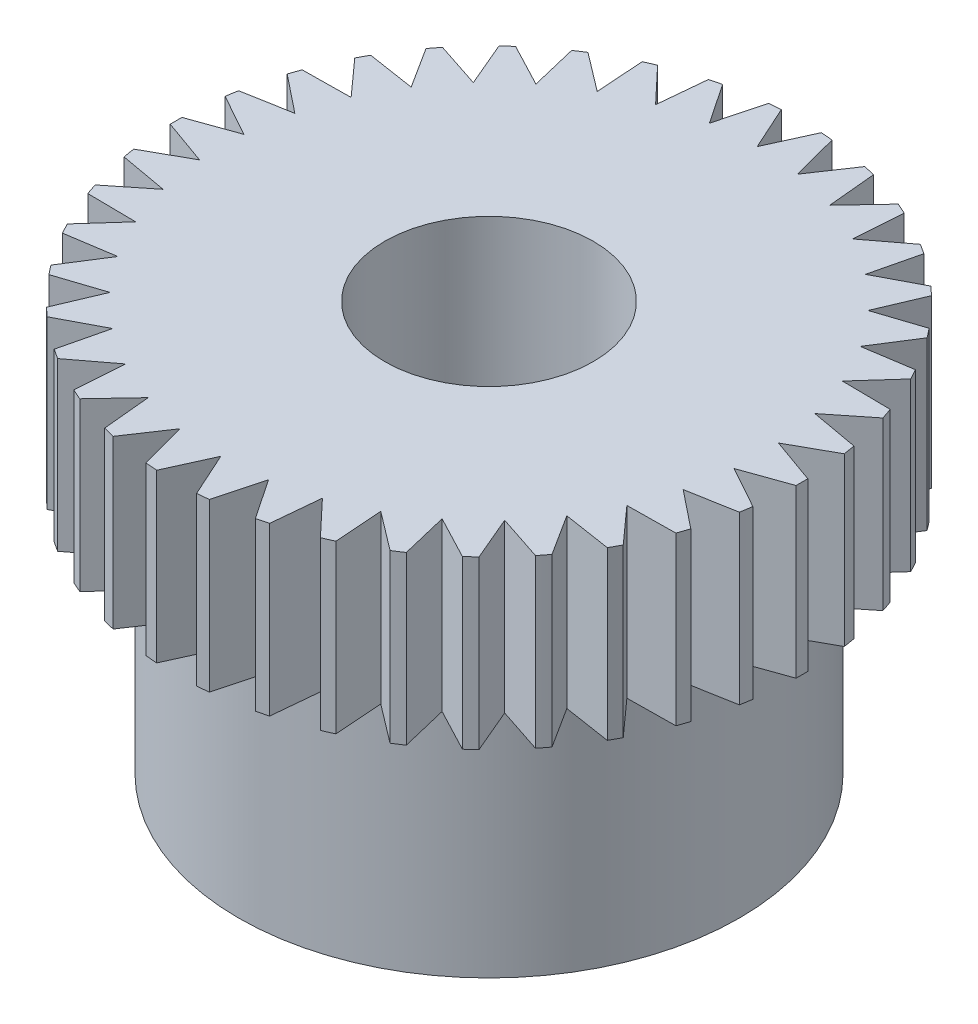
from build123d import *

# Parameters (mm, degrees)
SKETCH_1_R          = 6
EXTRUDE_1_DEPTH     = 5.8
SKETCH_2_R          = 7.5
EXTRUDE_2_DEPTH     = 4
CUT_EXTRUDE_3_DEPTH = 15.440914098
SKETCH_4_R          = 2.5
CUT_EXTRUDE_4_DEPTH = 15.43297622


with BuildPart() as part:
    # Эскиз1 → Вытянуть1 (new body)
    with BuildSketch(Plane(origin=(0, 0, 0), x_dir=(1, 0, 0), z_dir=(0, 1, 0))):
        with Locations(Location((0, 0, 0), (0, 0, 270))):
            Circle(SKETCH_1_R)
    extrude(amount=EXTRUDE_1_DEPTH)

    # Эскиз2 → Вытянуть2 (add)
    with BuildSketch(Plane(origin=(0, 5.8, 0), x_dir=(1, 0, 0), z_dir=(0, 1, 0))):
        with Locations(Location((0, 0, 0), (0, 0, 270))):
            Circle(SKETCH_2_R)
    extrude(amount=EXTRUDE_2_DEPTH)

    # Эскиз3 → Вытянуть3 (cut, through all)
    with BuildSketch(Plane(origin=(0, 9.8, 0), x_dir=(1, 0, 0), z_dir=(0, 1, 0))):
        Polygon((-0.62278932, 7.802539676), (0.62278932, 7.802539676), (0, 6.428342871), align=None)
        Polygon((0.669960535, 7.798630957), (1.898551107, 7.593615451), (1.058070461, 6.340668653), align=None)
        Polygon((1.944435614, 7.581995916), (3.122525368, 7.177557193), (2.087279518, 6.080037523), align=None)
        Polygon((3.165871558, 7.158543791), (4.261325277, 6.565713884), (3.059553031, 5.653558819), align=None)
        Polygon((4.300950779, 6.539825252), (5.283887341, 5.774775016), (3.948369913, 5.072865768), align=None)
        Polygon((5.318711274, 5.742717328), (6.162318733, 4.82631534), (4.729485556, 4.353798163), align=None)
        Polygon((6.19139119, 4.788963046), (6.872658133, 3.746206362), (5.381593163, 3.515970293), align=None)
        Polygon((6.895186095, 3.704578336), (7.395529336, 2.563910641), (5.886904936, 2.582235919), align=None)
        Polygon((7.410898297, 2.519142386), (7.716669776, 1.311678121), (6.231637289, 1.578064881), align=None)
        Polygon((7.724460512, 1.264990798), (7.827319581, 0.023666441), (6.406386821, 0.530848347), align=None)
        Polygon((7.827319581, -0.023666441), (7.724460512, -1.264990798), (6.406386821, -0.530848347), align=None)
        Polygon((7.716669776, -1.311678121), (7.410898297, -2.519142386), (6.231637289, -1.578064881), align=None)
        Polygon((7.395529336, -2.563910641), (6.895186095, -3.704578336), (5.886904936, -2.582235919), align=None)
        Polygon((6.872658133, -3.746206362), (6.19139119, -4.788963046), (5.381593163, -3.515970293), align=None)
        Polygon((6.162318733, -4.82631534), (5.318711274, -5.742717328), (4.729485556, -4.353798163), align=None)
        Polygon((5.283887341, -5.774775016), (4.300950779, -6.539825252), (3.948369913, -5.072865768), align=None)
        Polygon((4.261325277, -6.565713884), (3.165871558, -7.158543791), (3.059553031, -5.653558819), align=None)
        Polygon((3.122525368, -7.177557193), (1.944435614, -7.581995916), (2.087279518, -6.080037523), align=None)
        Polygon((1.898551107, -7.593615451), (0.669960535, -7.798630957), (1.058070461, -6.340668653), align=None)
        Polygon((0.62278932, -7.802539676), (-0.62278932, -7.802539676), (0, -6.428342871), align=None)
        Polygon((-0.669960535, -7.798630957), (-1.898551107, -7.593615451), (-1.058070461, -6.340668653), align=None)
        Polygon((-1.944435614, -7.581995916), (-3.122525368, -7.177557193), (-2.087279518, -6.080037523), align=None)
        Polygon((-3.165871558, -7.158543791), (-4.261325277, -6.565713884), (-3.059553031, -5.653558819), align=None)
        Polygon((-4.300950779, -6.539825252), (-5.283887341, -5.774775016), (-3.948369913, -5.072865768), align=None)
        Polygon((-5.318711274, -5.742717328), (-6.162318733, -4.82631534), (-4.729485556, -4.353798163), align=None)
        Polygon((-6.19139119, -4.788963046), (-6.872658133, -3.746206362), (-5.381593163, -3.515970293), align=None)
        Polygon((-6.895186095, -3.704578336), (-7.395529336, -2.563910641), (-5.886904936, -2.582235919), align=None)
        Polygon((-7.410898297, -2.519142386), (-7.716669776, -1.311678121), (-6.231637289, -1.578064881), align=None)
        Polygon((-7.724460512, -1.264990798), (-7.827319581, -0.023666441), (-6.406386821, -0.530848347), align=None)
        Polygon((-7.827319581, 0.023666441), (-7.724460512, 1.264990798), (-6.406386821, 0.530848347), align=None)
        Polygon((-7.716669776, 1.311678121), (-7.410898297, 2.519142386), (-6.231637289, 1.578064881), align=None)
        Polygon((-7.395529336, 2.563910641), (-6.895186095, 3.704578336), (-5.886904936, 2.582235919), align=None)
        Polygon((-6.872658133, 3.746206362), (-6.19139119, 4.788963046), (-5.381593163, 3.515970293), align=None)
        Polygon((-6.162318733, 4.82631534), (-5.318711274, 5.742717328), (-4.729485556, 4.353798163), align=None)
        Polygon((-5.283887341, 5.774775016), (-4.300950779, 6.539825252), (-3.948369913, 5.072865768), align=None)
        Polygon((-4.261325277, 6.565713884), (-3.165871558, 7.158543791), (-3.059553031, 5.653558819), align=None)
        Polygon((-3.122525368, 7.177557193), (-1.944435614, 7.581995916), (-2.087279518, 6.080037523), align=None)
        Polygon((-1.898551107, 7.593615451), (-0.669960535, 7.798630957), (-1.058070461, 6.340668653), align=None)
    extrude(amount=-CUT_EXTRUDE_3_DEPTH, mode=Mode.SUBTRACT)

    # Эскиз4 → Вытянуть4 (cut, through all)
    with BuildSketch(Plane.XZ):
        with Locations(Location((0, 0, 0), (0, 0, 270))):
            Circle(SKETCH_4_R)
    extrude(amount=-CUT_EXTRUDE_4_DEPTH, mode=Mode.SUBTRACT)


solid = part.part
